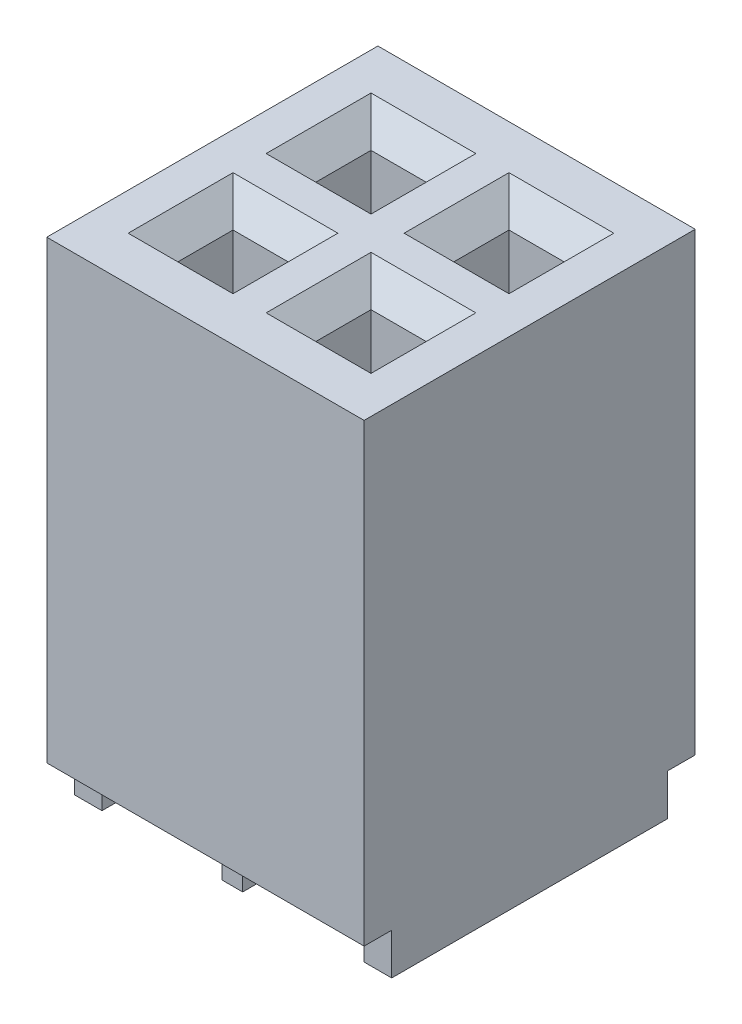
from build123d import *

# Parameters (mm, degrees)
SKETCH_1_W          = 3.048
SKETCH_1_H          = 4.191
EXTRUDE_1_DEPTH     = 2.921
SKETCH_2_W          = 0.254
SKETCH_2_H          = 2.54
EXTRUDE_2_DEPTH     = 0.381
SKETCH_3_W          = 0.254
SKETCH_3_H          = 2.54
EXTRUDE_3_DEPTH     = 0.381
SKETCH_4_W          = 0.1905
SKETCH_4_H          = 2.54
EXTRUDE_4_DEPTH     = 0.381
SKETCH_5_W          = 0.508
SKETCH_5_H          = 0.508
CUT_EXTRUDE_1_DEPTH = 3.302
SKETCH_6_W          = 0.508
SKETCH_6_H          = 0.508
CUT_EXTRUDE_2_DEPTH = 3.302
SKETCH_7_W          = 0.508
SKETCH_7_H          = 0.508
CUT_EXTRUDE_3_DEPTH = 3.302
SKETCH_8_W          = 0.508
SKETCH_8_H          = 0.508
CUT_EXTRUDE_4_DEPTH = 3.302
CHAMFER_1_SIZE      = 0.2286


with BuildPart() as part:
    # ｽｹｯﾁ1 → ﾎﾞｽ - 押し出し1 (new body)
    with BuildSketch(Plane(origin=(1.4605, 0, 0), x_dir=(0, 0, -1), z_dir=(1, 0, 0))):
        with Locations((0, 2.4765)):
            Rectangle(SKETCH_1_W, SKETCH_1_H)
    extrude(amount=-EXTRUDE_1_DEPTH)

    # ｽｹｯﾁ2 → ﾎﾞｽ - 押し出し2 (add)
    with BuildSketch(Plane.XZ.offset(-0.381)):
        with Locations((1.3335, 0)):
            Rectangle(SKETCH_2_W, SKETCH_2_H)
    extrude(amount=EXTRUDE_2_DEPTH)

    # ｽｹｯﾁ3 → ﾎﾞｽ - 押し出し3 (add)
    with BuildSketch(Plane.XZ.offset(-0.381)):
        with Locations((-1.3335, 0)):
            Rectangle(SKETCH_3_W, SKETCH_3_H)
    extrude(amount=EXTRUDE_3_DEPTH)

    # ｽｹｯﾁ4 → ﾎﾞｽ - 押し出し4 (add)
    with BuildSketch(Plane.XZ.offset(-0.381)):
        with Locations((-0.00635, 0)):
            Rectangle(SKETCH_4_W, SKETCH_4_H)
    extrude(amount=EXTRUDE_4_DEPTH)

    # ｽｹｯﾁ5 → ｶｯﾄ - 押し出し1 (cut)
    with BuildSketch(Plane(origin=(0, 4.572, 0), x_dir=(-1, 0, 0), z_dir=(0, 1, 0))):
        with Locations((0.635, 0.635)):
            Rectangle(SKETCH_5_W, SKETCH_5_H)
    extrude(amount=-CUT_EXTRUDE_1_DEPTH, mode=Mode.SUBTRACT)

    # ｽｹｯﾁ6 → ｶｯﾄ - 押し出し2 (cut)
    with BuildSketch(Plane(origin=(0, 4.572, 0), x_dir=(-1, 0, 0), z_dir=(0, 1, 0))):
        with Locations((-0.635, 0.635)):
            Rectangle(SKETCH_6_W, SKETCH_6_H)
    extrude(amount=-CUT_EXTRUDE_2_DEPTH, mode=Mode.SUBTRACT)

    # ｽｹｯﾁ7 → ｶｯﾄ - 押し出し3 (cut)
    with BuildSketch(Plane(origin=(0, 4.572, 0), x_dir=(-1, 0, 0), z_dir=(0, 1, 0))):
        with Locations((0.635, -0.635)):
            Rectangle(SKETCH_7_W, SKETCH_7_H)
    extrude(amount=-CUT_EXTRUDE_3_DEPTH, mode=Mode.SUBTRACT)

    # ｽｹｯﾁ8 → ｶｯﾄ - 押し出し4 (cut)
    with BuildSketch(Plane(origin=(0, 4.572, 0), x_dir=(-1, 0, 0), z_dir=(0, 1, 0))):
        with Locations((-0.635, -0.635)):
            Rectangle(SKETCH_8_W, SKETCH_8_H)
    extrude(amount=-CUT_EXTRUDE_4_DEPTH, mode=Mode.SUBTRACT)

    # 面取り1
    chamfer_1_edges = [part.edges().sort_by_distance(p)[0] for p in [
        (-0.635, 4.572, 0.381),
        (-0.889, 4.572, 0.635),
        (-0.635, 4.572, 0.889),
        (-0.381, 4.572, 0.635),
        (0.635, 4.572, 0.381),
        (0.381, 4.572, 0.635),
        (0.635, 4.572, 0.889),
        (0.889, 4.572, 0.635),
        (-0.635, 4.572, -0.889),
        (-0.889, 4.572, -0.635),
        (-0.635, 4.572, -0.381),
        (-0.381, 4.572, -0.635),
        (0.635, 4.572, -0.889),
        (0.381, 4.572, -0.635),
        (0.635, 4.572, -0.381),
        (0.889, 4.572, -0.635),
    ]]
    chamfer(chamfer_1_edges, length=CHAMFER_1_SIZE)


solid = part.part
